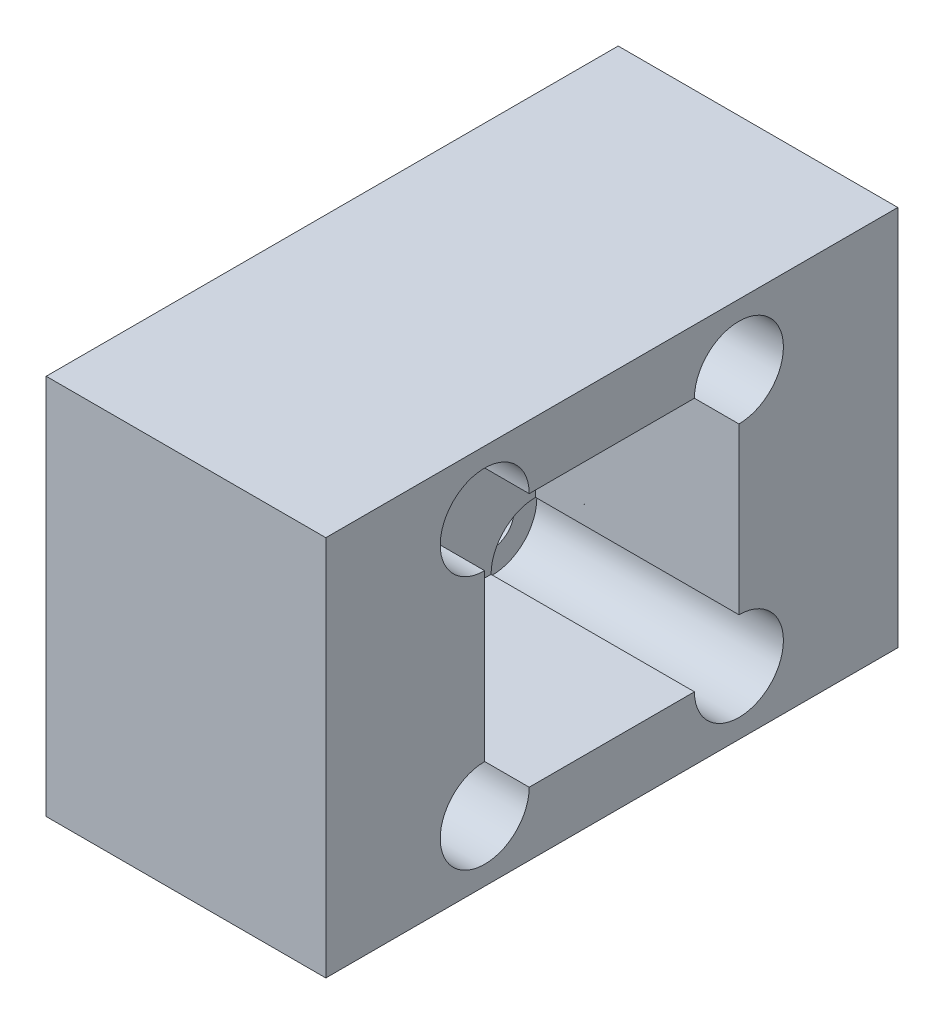
from build123d import *

# Parameters (mm, degrees)
SKETCH1_W                                = 45
SKETCH1_H                                = 30
BOSS_EXTRUDE1_DEPTH                      = 22
SKETCH3_W                                = 20
SKETCH3_H                                = 20
CUT_EXTRUDE1_DEPTH                       = 16
CBORE_FOR_M3_PAN_HEAD_SCREW4_D           = 3.4
CBORE_FOR_M3_PAN_HEAD_SCREW4_CBORE_D     = 7
CBORE_FOR_M3_PAN_HEAD_SCREW4_CBORE_DEPTH = 19.4


with BuildPart() as part:
    # Sketch1 → Boss-Extrude1 (new body)
    with BuildSketch(Plane(origin=(0, 0, 0), x_dir=(0, 0, -1), z_dir=(1, 0, 0))):
        with Locations((22.5, 15)):
            Rectangle(SKETCH1_W, SKETCH1_H)
    extrude(amount=BOSS_EXTRUDE1_DEPTH)

    # Sketch3 → Cut-Extrude1 (cut)
    with BuildSketch(Plane(origin=(22, 0, 0), x_dir=(0, 0, -1), z_dir=(1, 0, 0))):
        with Locations((22.5, 15)):
            Rectangle(SKETCH3_W, SKETCH3_H)
    extrude(amount=-CUT_EXTRUDE1_DEPTH, mode=Mode.SUBTRACT)

    # CBORE for M3 Pan Head Screw4 (through all)
    with Locations(Plane(origin=(22, 0, 0), x_dir=(0, 0, -1), z_dir=(1, 0, 0))):
        with Locations((12.5, 25), (32.5, 25), (32.5, 5), (12.5, 5)):
            CounterBoreHole(CBORE_FOR_M3_PAN_HEAD_SCREW4_D / 2, CBORE_FOR_M3_PAN_HEAD_SCREW4_CBORE_D / 2, CBORE_FOR_M3_PAN_HEAD_SCREW4_CBORE_DEPTH)


solid = part.part
